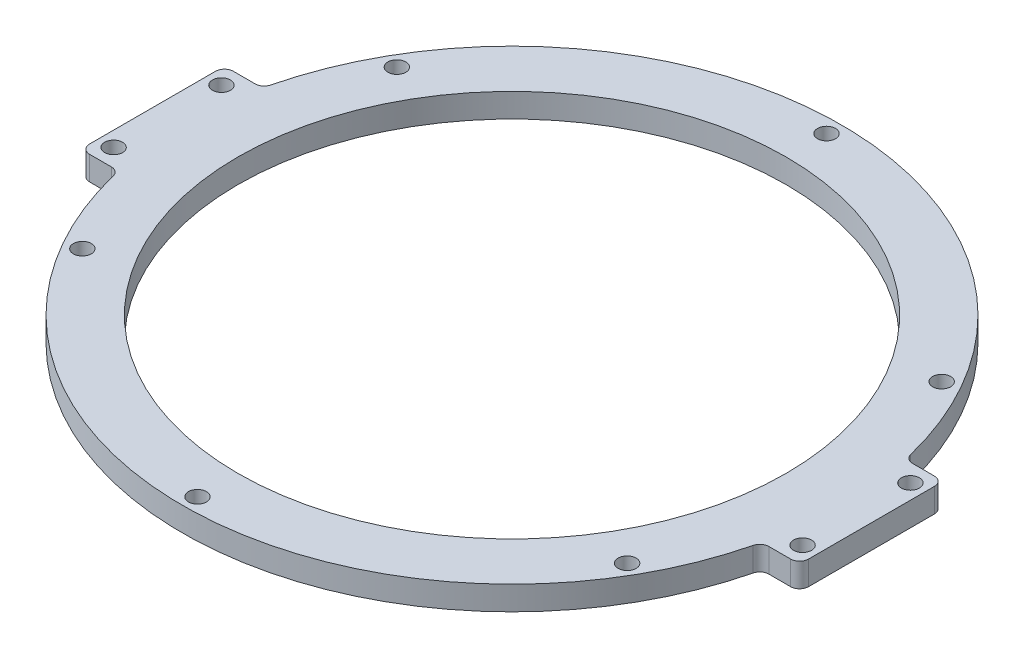
from build123d import *

# Parameters (mm, degrees)
SKETCH_1_R      = 45.75
SKETCH_1_R_2    = 1.5
EXTRUDE_1_DEPTH = 4


with BuildPart() as part:
    # 草图1 → 凸台-拉伸1 (new body)
    with BuildSketch(Plane(origin=(0, 0, 0), x_dir=(1, 0, 0), z_dir=(0, 1, 0))):
        with BuildLine():
            Line((-60, -10.5), (-60, 10.5))
            ThreePointArc((-60, 10.5), (-59.560660172, 11.560660172), (-58.5, 12))
            Line((-58.5, 12), (-54.863466897, 12))
            ThreePointArc((-54.863466897, 12), (-53.938159008, 12.31940468), (-53.406914679, 13.14159292))
            ThreePointArc((-53.406914679, 13.14159292), (0, 55), (53.406914679, 13.14159292))
            ThreePointArc((53.406914679, 13.14159292), (53.938159008, 12.31940468), (54.863466897, 12))
            Line((54.863466897, 12), (58.5, 12))
            ThreePointArc((58.5, 12), (59.560660172, 11.560660172), (60, 10.5))
            Line((60, 10.5), (60, -10.5))
            ThreePointArc((60, -10.5), (59.560660172, -11.560660172), (58.5, -12))
            Line((58.5, -12), (54.863466897, -12))
            ThreePointArc((54.863466897, -12), (53.938159008, -12.31940468), (53.406914679, -13.14159292))
            ThreePointArc((53.406914679, -13.14159292), (0, -55), (-53.406914679, -13.14159292))
            ThreePointArc((-53.406914679, -13.14159292), (-53.938159008, -12.31940468), (-54.863466897, -12))
            Line((-54.863466897, -12), (-58.5, -12))
            ThreePointArc((-58.5, -12), (-59.560660172, -11.560660172), (-60, -10.5))
        make_face()
        with Locations(Location((0, 0, 0), (0, 0, 270))):
            Circle(SKETCH_1_R, mode=Mode.SUBTRACT)
        with Locations(Location((0, 52.5, 0), (0, 0, 270))):
            Circle(SKETCH_1_R_2, mode=Mode.SUBTRACT)
        with Locations(Location((45.466333699, 26.25, 0), (0, 0, 270))):
            Circle(SKETCH_1_R_2, mode=Mode.SUBTRACT)
        with Locations(Location((45.466333699, -26.25, 0), (0, 0, 270))):
            Circle(SKETCH_1_R_2, mode=Mode.SUBTRACT)
        with Locations(Location((0, -52.5, 0), (0, 0, 270))):
            Circle(SKETCH_1_R_2, mode=Mode.SUBTRACT)
        with Locations(Location((-45.466333699, -26.25, 0), (0, 0, 270))):
            Circle(SKETCH_1_R_2, mode=Mode.SUBTRACT)
        with Locations(Location((-45.466333699, 26.25, 0), (0, 0, 270))):
            Circle(SKETCH_1_R_2, mode=Mode.SUBTRACT)
        with Locations(Location((-57.5, 9, 0), (0, 0, 270))):
            Circle(SKETCH_1_R_2, mode=Mode.SUBTRACT)
        with Locations(Location((57.5, 9, 0), (0, 0, 90))):
            Circle(SKETCH_1_R_2, mode=Mode.SUBTRACT)
        with Locations(Location((57.5, -9, 0), (0, 0, 270))):
            Circle(SKETCH_1_R_2, mode=Mode.SUBTRACT)
        with Locations(Location((-57.5, -9, 0), (0, 0, 90))):
            Circle(SKETCH_1_R_2, mode=Mode.SUBTRACT)
    extrude(amount=EXTRUDE_1_DEPTH)


solid = part.part
